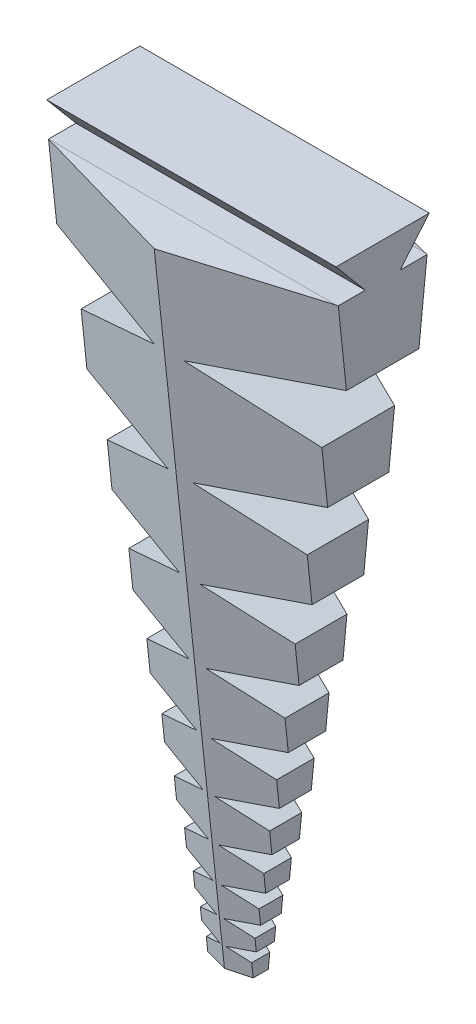
from build123d import *

# Parameters (mm, degrees)
CUT_EXTRUDE2_DEPTH      = 104.832798419
CUT_EXTRUDE2_DEPTH_BACK = 104.832798419
CUT_EXTRUDE3_DEPTH      = 110.008908257
CUT_EXTRUDE3_DEPTH_BACK = 110.008908257
CUT_EXTRUDE5_DEPTH      = 10
CUT_EXTRUDE6_DEPTH      = 10
CUT_EXTRUDE7_DEPTH      = 5


with BuildPart() as part:
    # Sketch2 → Loft1 section 0
    with BuildSketch(Plane(origin=(0, 0, 0), x_dir=(1, 0, 0), z_dir=(0, 1, 0))):
        with BuildLine():
            Line((0.013558001, 1.959309758), (-3.238400261, 1.087950168))
            Line((-3.238400261, 1.087950168), (-3.238400261, -1.087950168))
            Line((-3.238400261, -1.087950168), (0.013558001, -1.959309758))
            Line((0.013558001, -1.959309758), (3.265516264, -1.087950168))
            Line((3.265516264, -1.087950168), (3.265516264, 1.087950168))
            Line((3.265516264, 1.087950168), (0.013558001, 1.959309758))
        make_face()
    # Sketch3 → Loft1 section 1
    with BuildSketch(Plane(origin=(0, 100, 0), x_dir=(1, 0, 0), z_dir=(0, 1, 0))):
        with BuildLine():
            Line((-0.123443963, 12.5), (-25, 5.834346899))
            Line((-25, 5.834346899), (-25, -5.834346899))
            Line((-25, -5.834346899), (-0.123443963, -12.5))
            Line((-0.123443963, -12.5), (24.753112074, -5.834346899))
            Line((24.753112074, -5.834346899), (24.753112074, 5.834346899))
            Line((24.753112074, 5.834346899), (-0.123443963, 12.5))
        make_face()
    loft()

    # spiral_flat → Cut-Extrude2 (cut, two sides: drawn at the far end of the back side and taken through both)
    with BuildSketch(Plane.XY.offset(-CUT_EXTRUDE2_DEPTH_BACK)):
        Polygon((-20.776742097, 100), (-25, 100), (-3.265516264, 0), (-3.265516264, 2.008489475), (-0.392929297, 3.054025626), (-3.929292967, 3.677581955), (-3.929292967, 5.470777811), (-0.472799459, 6.728838563), (-4.727994587, 7.479144272), (-4.727994587, 9.636840421), (-0.568904711, 11.150625338), (-5.689047114, 12.053444588), (-5.689047114, 14.64973247), (-0.684545138, 16.471222227), (-6.84545138, 17.557556223), (-6.84545138, 20.681587736), (-0.823691624, 22.873329044), (-8.236916245, 24.180480559), (-8.236916245, 27.939529377), (-0.991122213, 30.576782728), (-9.911222133, 32.149637014), (-9.911222133, 36.672782174), (-1.192586172, 39.846106147), (-11.925861724, 41.738672218), (-11.925861724, 47.181230462), (-1.435001415, 50.999591347), (-14.35001415, 53.276856548), (-14.35001415, 59.825715627), (-1.726692049, 64.420229129), (-17.266920487, 67.160390689), (-17.266920487, 75.040426751), (-2.07767421, 80.568860277), (-20.776742097, 83.866010459), align=None)
        Polygon((3.265516264, 2.008489475), (3.265516264, 0), (25, 100), (20.776742097, 100), (20.776742097, 83.866010459), (2.07767421, 80.568860277), (17.266920487, 75.040426751), (17.266920487, 67.160390689), (1.726692049, 64.420229129), (14.35001415, 59.825715627), (14.35001415, 53.276856548), (1.435001415, 50.999591347), (11.925861724, 47.181230462), (11.925861724, 41.738672218), (1.192586172, 39.846106147), (9.911222133, 36.672782174), (9.911222133, 32.149637014), (0.991122213, 30.576782728), (8.236916245, 27.939529377), (8.236916245, 24.180480559), (0.823691624, 22.873329044), (6.84545138, 20.681587736), (6.84545138, 17.557556223), (0.684545138, 16.471222227), (5.689047114, 14.64973247), (5.689047114, 12.053444588), (0.568904711, 11.150625338), (4.727994587, 9.636840421), (4.727994587, 7.479144272), (0.472799459, 6.728838563), (3.929292967, 5.470777811), (3.929292967, 3.677581955), (0.392929297, 3.054025626), align=None)
    extrude(amount=CUT_EXTRUDE2_DEPTH + CUT_EXTRUDE2_DEPTH_BACK, mode=Mode.SUBTRACT)

    # Sketch6 → Cut-Extrude3 (cut, two sides: drawn at the far end of the back side and taken through both)
    with BuildSketch(Plane.ZY.offset(20.776742097).offset(-CUT_EXTRUDE3_DEPTH_BACK)):
        Polygon((2.5, 95), (6.695498156, 100), (6.965965444, 100), (6.437095454, 95), align=None)
        Polygon((-2.5, 95), (-6.695498156, 100), (-6.965965444, 100), (-6.437095454, 95), align=None)
    extrude(amount=CUT_EXTRUDE3_DEPTH + CUT_EXTRUDE3_DEPTH_BACK, mode=Mode.SUBTRACT)

    # Sketch9 → Cut-Extrude5 (cut)
    with BuildSketch(Plane(origin=(0, 0.377769316, -3.571476193), x_dir=(-1, 0, 0), z_dir=(0, 0.10518721022967682, -0.9944524376781918))):
        Polygon((-20.543554367, 95.150081692), (-20.529854171, 100.177974239), (20.776742097, 100.177974239), (20.776742097, 95.150081692), align=None)
    extrude(amount=-CUT_EXTRUDE5_DEPTH, mode=Mode.SUBTRACT)


with BuildPart() as cut_extrude5_piece_1:
    # of the separate pieces the step leaves, piece 1, a body of its own (cut_extrude5_pieces)
    add(part.part.solids().sort_by_distance((0.013558001, 0, -1.959309758))[0])

    # Sketch10 → Cut-Extrude6 (cut)
    with BuildSketch(Plane(origin=(0, 0.377769316, 3.571476193), x_dir=(1, 0, 0), z_dir=(0, 0.10518721022967828, 0.9944524376781916))):
        Polygon((20.529854171, 100.177974239), (20.543554367, 95.150081692), (-20.776742097, 95.150081692), (-20.776742097, 100.177974239), align=None)
    extrude(amount=-CUT_EXTRUDE6_DEPTH, mode=Mode.SUBTRACT)


with BuildPart() as cut_extrude5_piece_2:
    # of the separate pieces the step leaves, piece 2, a body of its own (cut_extrude5_pieces)
    add(part.part.solids().sort_by_distance((-20.776742097, 100, 6.965965444))[0])


with BuildPart() as cut_extrude6_piece_1:
    # of the separate pieces the step leaves, piece 1, a body of its own (cut_extrude6_pieces)
    add(cut_extrude5_piece_1.part.solids().sort_by_distance((0.013558001, 0, -1.959309758))[0])


with BuildPart() as cut_extrude6_piece_2:
    # of the separate pieces the step leaves, piece 2, a body of its own (cut_extrude6_pieces)
    add(cut_extrude5_piece_1.part.solids().sort_by_distance((-0.122650855, 99.421097404, -12.438979671))[0])


with BuildPart() as cut_extrude7_tool:
    # Sketch11 → Cut-Extrude7 (new body)
    with BuildSketch(Plane(origin=(0, 100, 0), x_dir=(1, 0, 0), z_dir=(0, 1, 0))):
        Polygon((-0.123443963, -12.5), (20.529854171, -6.965965444), (-20.776742097, -6.965965444), align=None)
        Polygon((-0.123443963, 12.5), (-20.776742097, 6.965965444), (20.529854171, 6.965965444), align=None)
    extrude(amount=-CUT_EXTRUDE7_DEPTH)


with BuildPart() as cut_extrude5_piece_2_1:
    add(cut_extrude5_piece_2.part)

    # Cut-Extrude7: cut by cut_extrude7_tool
    add(cut_extrude7_tool.part, mode=Mode.SUBTRACT)


with BuildPart() as cut_extrude6_piece_2_1:
    add(cut_extrude6_piece_2.part)

    # Cut-Extrude7: cut by cut_extrude7_tool
    add(cut_extrude7_tool.part, mode=Mode.SUBTRACT)


solid = cut_extrude6_piece_1.part
